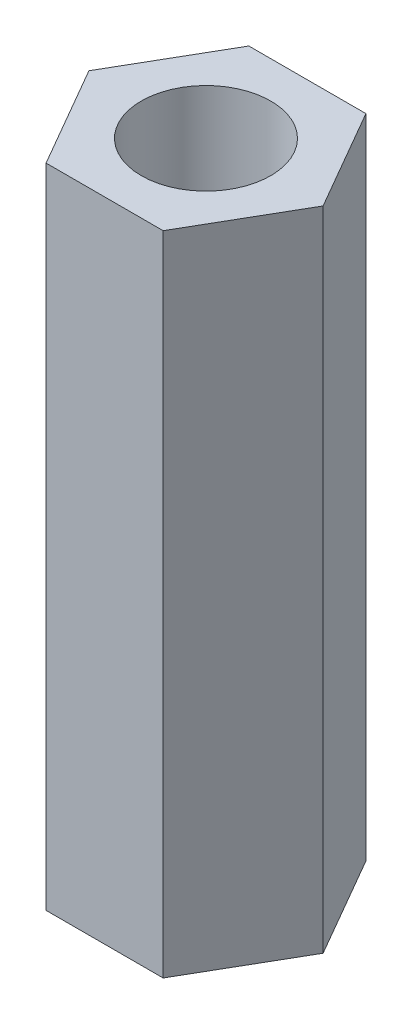
from build123d import *

# Parameters (mm, degrees)
SKETCH_1_R      = 1.5
EXTRUDE_2_DEPTH = 15


with BuildPart() as part:
    # 草图1 → 凸台-拉伸2 (new body)
    with BuildSketch(Plane(origin=(0, 0, 0), x_dir=(1, 0, 0), z_dir=(0, 1, 0))):
        Polygon((2.713546265, 0), (1.356773133, 2.35), (-1.356773133, 2.35), (-2.713546265, 0), (-1.356773133, -2.35), (1.356773133, -2.35), align=None)
        with Locations(Location((0, 0, 0), (0, 0, 270))):
            Circle(SKETCH_1_R, mode=Mode.SUBTRACT)
    extrude(amount=EXTRUDE_2_DEPTH)


solid = part.part
